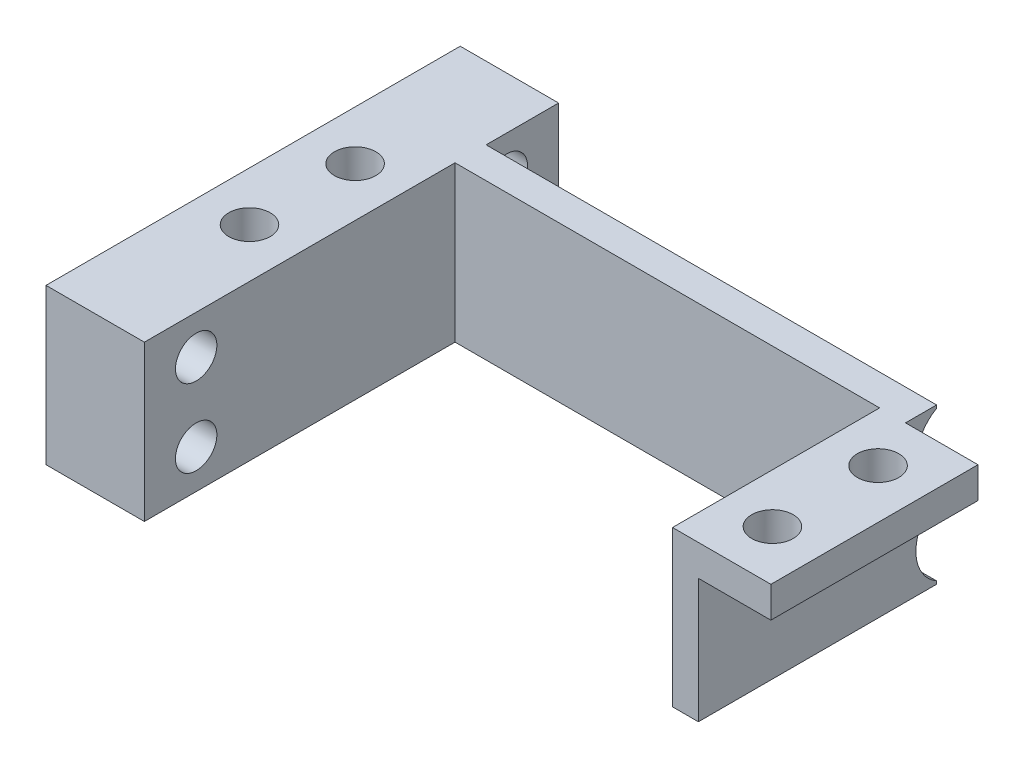
from build123d import *

# Parameters (mm, degrees)
SKETCH1_W           = 46
SKETCH1_H           = 15
BOSS_EXTRUDE1_DEPTH = 3
SKETCH3_W           = 2.5
SKETCH3_H           = 15
BOSS_EXTRUDE2_DEPTH = 20
SKETCH4_W           = 20
SKETCH4_H           = 3
BOSS_EXTRUDE3_DEPTH = 7
SKETCH5_R           = 2
CUT_EXTRUDE1_DEPTH  = 7
SKETCH7_W           = 9.5
SKETCH7_H           = 15
BOSS_EXTRUDE4_DEPTH = 10
SKETCH8_R           = 2
CUT_EXTRUDE2_DEPTH  = 10
CUT_EXTRUDE3_DEPTH  = 43.5


with BuildPart() as part:
    # Sketch1 → Boss-Extrude1 (new body)
    with BuildSketch(Plane.XY):
        with Locations((23, 7.5)):
            Rectangle(SKETCH1_W, SKETCH1_H)
    extrude(amount=BOSS_EXTRUDE1_DEPTH)

    # Sketch3 → Boss-Extrude2 (add)
    with BuildSketch(Plane.XY.offset(3)):
        with Locations((1.25, 7.5)):
            Rectangle(SKETCH3_W, SKETCH3_H)
    boss_extrude2 = extrude(amount=BOSS_EXTRUDE2_DEPTH)

    # Sketch4 → Boss-Extrude3 (add)
    with BuildSketch(Plane.ZY):
        with Locations((13, 13.5)):
            Rectangle(SKETCH4_W, SKETCH4_H)
    boss_extrude3 = extrude(amount=BOSS_EXTRUDE3_DEPTH)

    # Sketch5 → Cut-Extrude1 (cut)
    with BuildSketch(Plane(origin=(0, 15, 0), x_dir=(1, 0, 0), z_dir=(0, 1, 0))):
        with Locations(Location((-2.25, -18.1, 0), (0, 0, 270))):
            Circle(SKETCH5_R)
        with Locations(Location((-2.25, -7.9, 0), (0, 0, 270))):
            Circle(SKETCH5_R)
    cut_extrude1 = extrude(amount=-CUT_EXTRUDE1_DEPTH, mode=Mode.SUBTRACT)

    # Mirror1: Boss-Extrude2, Boss-Extrude3, Cut-Extrude1 across plane
    add(boss_extrude2.mirror(Plane(origin=(23, 0, 0), x_dir=(0, 0, 1), z_dir=(1, 0, 0))))
    add(boss_extrude3.mirror(Plane(origin=(23, 0, 0), x_dir=(0, 0, 1), z_dir=(1, 0, 0))))
    add(cut_extrude1.mirror(Plane(origin=(23, 0, 0), x_dir=(0, 0, 1), z_dir=(1, 0, 0))), mode=Mode.SUBTRACT)

    # Sketch7 → Boss-Extrude4 (add)
    with BuildSketch(Plane.XY.offset(23)):
        with Locations((-2.25, 7.5)):
            Rectangle(SKETCH7_W, SKETCH7_H)
    boss_extrude4 = extrude(amount=BOSS_EXTRUDE4_DEPTH)

    # Sketch8 → Cut-Extrude2 (cut)
    with BuildSketch(Plane.ZY.offset(7)):
        with Locations((28, 11.25)):
            Circle(SKETCH8_R)
        with Locations((28, 3.75)):
            Circle(SKETCH8_R)
    cut_extrude2 = extrude(amount=-CUT_EXTRUDE2_DEPTH, mode=Mode.SUBTRACT)

    # Mirror4: Boss-Extrude4, Cut-Extrude2 across plane
    add(boss_extrude4.mirror(Plane.XY.offset(13)))
    add(cut_extrude2.mirror(Plane.XY.offset(13)), mode=Mode.SUBTRACT)

    # Sketch9 → Cut-Extrude3 (cut)
    with BuildSketch(Plane(origin=(2.5, 0, 0), x_dir=(0, 0, -1), z_dir=(1, 0, 0))):
        with BuildLine():
            ThreePointArc((0.608058909, 7.5), (2, -0.25), (3.391941091, 7.5))
            ThreePointArc((3.391941091, 7.5), (2, 15.25), (0.608058909, 7.5))
        make_face()
    extrude(amount=CUT_EXTRUDE3_DEPTH, mode=Mode.SUBTRACT)


solid = part.part
